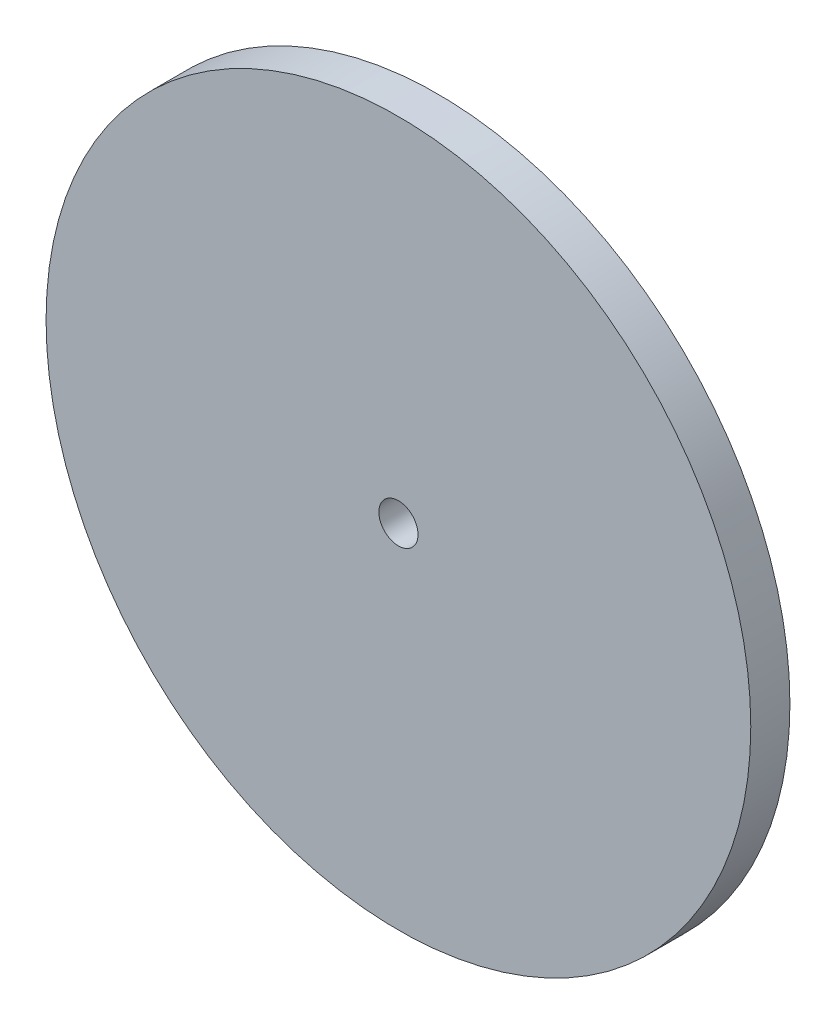
from build123d import *

# Parameters (mm, degrees)
ESBO_O1_R       = 45
ESBO_O1_R_2     = 2.5
EXTRUS_O1_DEPTH = 5


with BuildPart() as part:
    # Esboço1 → Extrusão1 (new body)
    with BuildSketch(Plane.XY):
        Circle(ESBO_O1_R)
        Circle(ESBO_O1_R_2, mode=Mode.SUBTRACT)
    extrude(amount=EXTRUS_O1_DEPTH)


solid = part.part
